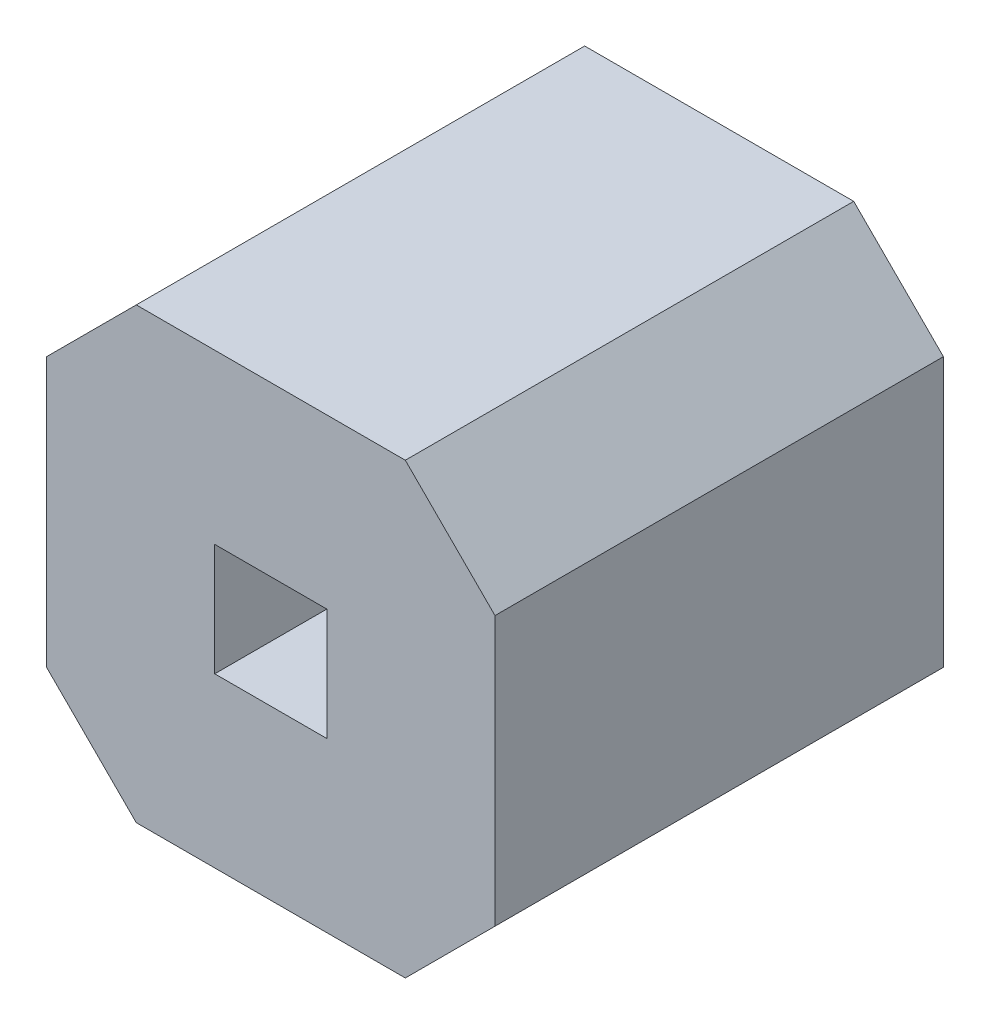
from build123d import *

# Parameters (mm, degrees)
SKETCH1_W           = 0.635
SKETCH1_H           = 0.635
BOSS_EXTRUDE1_DEPTH = 2.54


with BuildPart() as part:
    # Sketch1 → Boss-Extrude1 (new body)
    with BuildSketch(Plane.XY):
        Polygon((2.032, 2.54), (2.54, 2.032), (2.54, 0.508), (2.032, 0), (0.508, 0), (0, 0.508), (0, 2.032), (0.508, 2.54), align=None)
        with Locations((1.27, 1.27)):
            Rectangle(SKETCH1_W, SKETCH1_H, mode=Mode.SUBTRACT)
    extrude(amount=BOSS_EXTRUDE1_DEPTH)


solid = part.part
